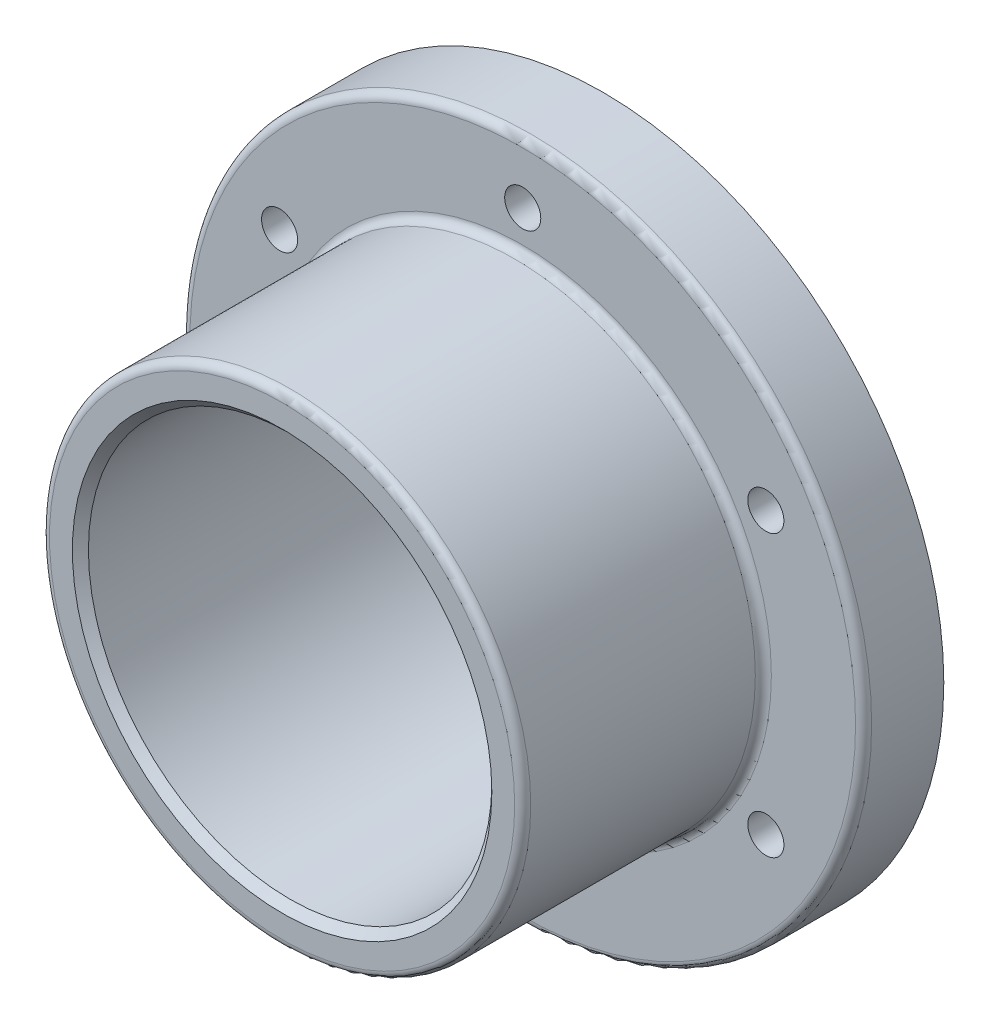
from build123d import *

# Parameters (mm, degrees)
SKETCH1_R           = 42.5
BOSS_EXTRUDE1_DEPTH = 10
SKETCH2_R           = 30
BOSS_EXTRUDE2_DEPTH = 30
SKETCH3_R           = 25.15
CUT_EXTRUDE1_DEPTH  = 73.197645391
CHAMFER1_SIZE       = 1
FILLET1_R           = 1
SKETCH4_R           = 2.25
CUT_EXTRUDE2_DEPTH  = 68.175144276
CIRPATTERN1_COUNT   = 6


with BuildPart() as part:
    # Sketch1 → Boss-Extrude1 (new body)
    with BuildSketch(Plane.XY):
        Circle(SKETCH1_R)
    extrude(amount=BOSS_EXTRUDE1_DEPTH)

    # Sketch2 → Boss-Extrude2 (add)
    with BuildSketch(Plane.XY.offset(10)):
        Circle(SKETCH2_R)
    extrude(amount=BOSS_EXTRUDE2_DEPTH)

    # Sketch3 → Cut-Extrude1 (cut, through all)
    with BuildSketch(Plane.XY.offset(40)):
        Circle(SKETCH3_R)
    extrude(amount=-CUT_EXTRUDE1_DEPTH, mode=Mode.SUBTRACT)

    # Chamfer1
    chamfer1_edges = [part.edges().sort_by_distance(p)[0] for p in [
        (-25.15, 0, 0),
        (-25.15, 0, 40),
    ]]
    chamfer(chamfer1_edges, length=CHAMFER1_SIZE)

    # Fillet1
    fillet1_edges = [part.edges().sort_by_distance(p)[0] for p in [
        (-42.5, 0, 10),
        (-30, 0, 10),
        (-30, 0, 40),
    ]]
    fillet(fillet1_edges, radius=FILLET1_R)

    # Sketch4 → Cut-Extrude2 (cut, through all)
    with BuildSketch(Plane.XY.offset(10)):
        with Locations((0, 35)):
            Circle(SKETCH4_R)
    cut_extrude2 = extrude(amount=-CUT_EXTRUDE2_DEPTH, mode=Mode.SUBTRACT)

    # CirPattern1: Cut-Extrude2 ×6 about axis
    cirpattern1_axis = Axis((0, 0, 0), (0, 0, 1))
    for i in range(1, CIRPATTERN1_COUNT):
        add(cut_extrude2.rotate(cirpattern1_axis, i * 360 / CIRPATTERN1_COUNT), mode=Mode.SUBTRACT)


solid = part.part
